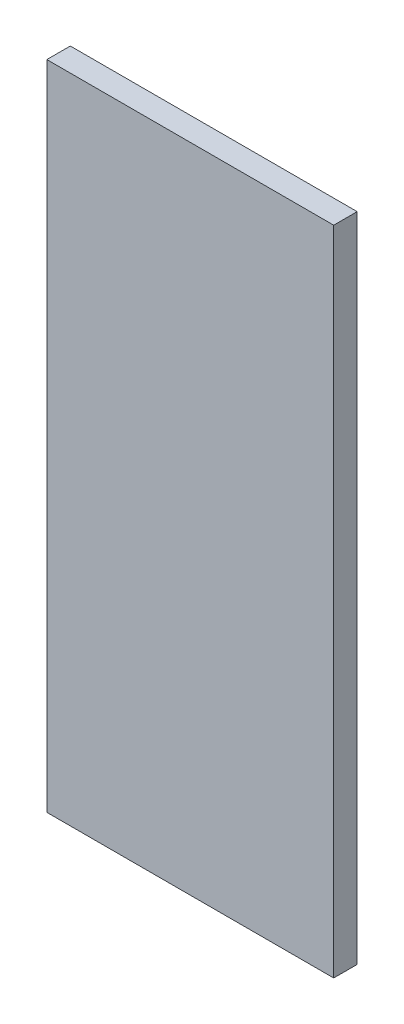
from build123d import *

# Parameters (mm, degrees)
SKETCH1_W           = 220
SKETCH1_H           = 500
BOSS_EXTRUDE1_DEPTH = 18


with BuildPart() as part:
    # Sketch1 → Boss-Extrude1 (new body)
    with BuildSketch(Plane.XY):
        Rectangle(SKETCH1_W, SKETCH1_H)
    extrude(amount=BOSS_EXTRUDE1_DEPTH)


solid = part.part
